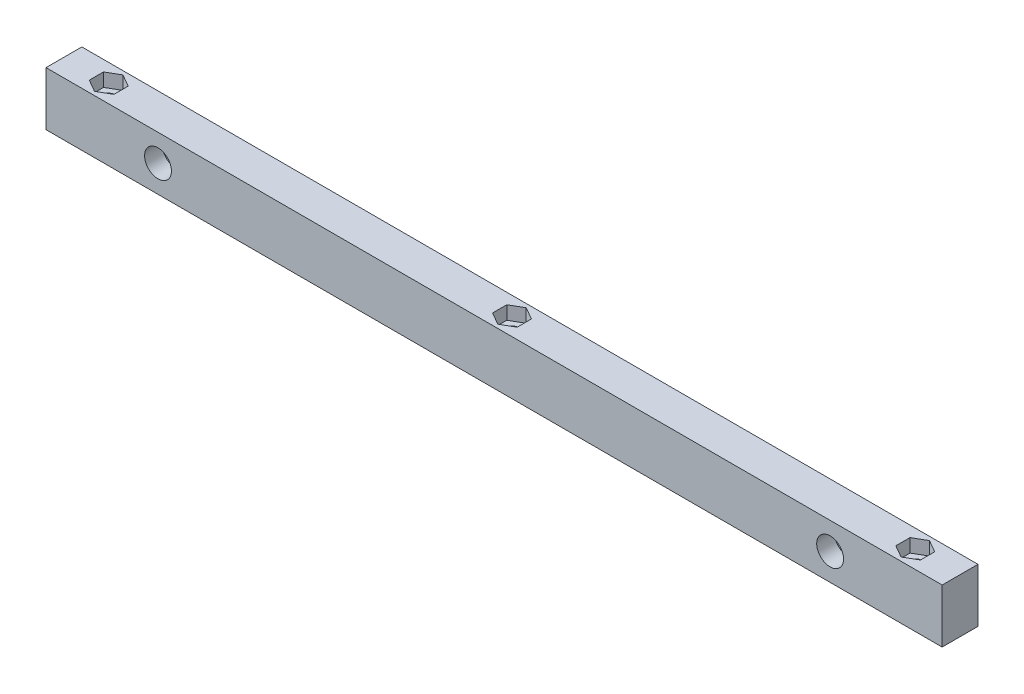
from build123d import *

# Parameters (mm, degrees)
ESQUISSE1_W             = 200
ESQUISSE1_H             = 8
BOSS_EXTRU_1_DEPTH      = 12
ESQUISSE2_R             = 1.5
ENL_V_MAT_EXTRU_1_DEPTH = 102.034647523
ESQUISSE3_R             = 1.5
ENL_V_MAT_EXTRU_2_DEPTH = 102.034647523
ESQUISSE4_R             = 3
ENL_V_MAT_EXTRU_3_DEPTH = 4
ENL_V_MAT_EXTRU_4_DEPTH = 3


with BuildPart() as part:
    # Esquisse1 → Boss.-Extru.1 (new body)
    with BuildSketch(Plane(origin=(0, 0, 0), x_dir=(1, 0, 0), z_dir=(0, 1, 0))):
        with Locations((0, 4)):
            Rectangle(ESQUISSE1_W, ESQUISSE1_H)
    extrude(amount=BOSS_EXTRU_1_DEPTH)

    # Esquisse2 → Enlèv. mat.-Extru.1 (cut, through all)
    with BuildSketch(Plane(origin=(0, 12, 0), x_dir=(1, 0, 0), z_dir=(0, 1, 0))):
        with Locations(Location((-90, 4, 0), (0, 0, 270))):
            Circle(ESQUISSE2_R)
        with Locations(Location((0, 4, 0), (0, 0, 270))):
            Circle(ESQUISSE2_R)
        with Locations(Location((90, 4, 0), (0, 0, 270))):
            Circle(ESQUISSE2_R)
    extrude(amount=-ENL_V_MAT_EXTRU_1_DEPTH, mode=Mode.SUBTRACT)

    # Esquisse3 → Enlèv. mat.-Extru.2 (cut, through all)
    with BuildSketch(Plane.XY):
        with Locations((-75, 6)):
            Circle(ESQUISSE3_R)
        with Locations(Location((75, 6, 0), (0, 0, 180))):
            Circle(ESQUISSE3_R)
    extrude(amount=-ENL_V_MAT_EXTRU_2_DEPTH, mode=Mode.SUBTRACT)

    # Esquisse4 → Enlèv. mat.-Extru.3 (cut)
    with BuildSketch(Plane.XY):
        with Locations((-75, 6)):
            Circle(ESQUISSE4_R)
        with Locations((75, 6)):
            Circle(ESQUISSE4_R)
    extrude(amount=-ENL_V_MAT_EXTRU_3_DEPTH, mode=Mode.SUBTRACT)

    # Esquisse5 → Enlèv. mat.-Extru.4 (cut)
    with BuildSketch(Plane(origin=(0, 12, 0), x_dir=(1, 0, 0), z_dir=(0, 1, 0))):
        Polygon((-87.25, 5.58771324), (-90, 7.175426481), (-92.75, 5.58771324), (-92.75, 2.41228676), (-90, 0.824573519), (-87.25, 2.41228676), align=None)
        Polygon((2.75, 5.58771324), (0, 7.175426481), (-2.75, 5.58771324), (-2.75, 2.41228676), (0, 0.824573519), (2.75, 2.41228676), align=None)
        Polygon((92.75, 5.58771324), (90, 7.175426481), (87.25, 5.58771324), (87.25, 2.41228676), (90, 0.824573519), (92.75, 2.41228676), align=None)
    extrude(amount=-ENL_V_MAT_EXTRU_4_DEPTH, mode=Mode.SUBTRACT)


solid = part.part
